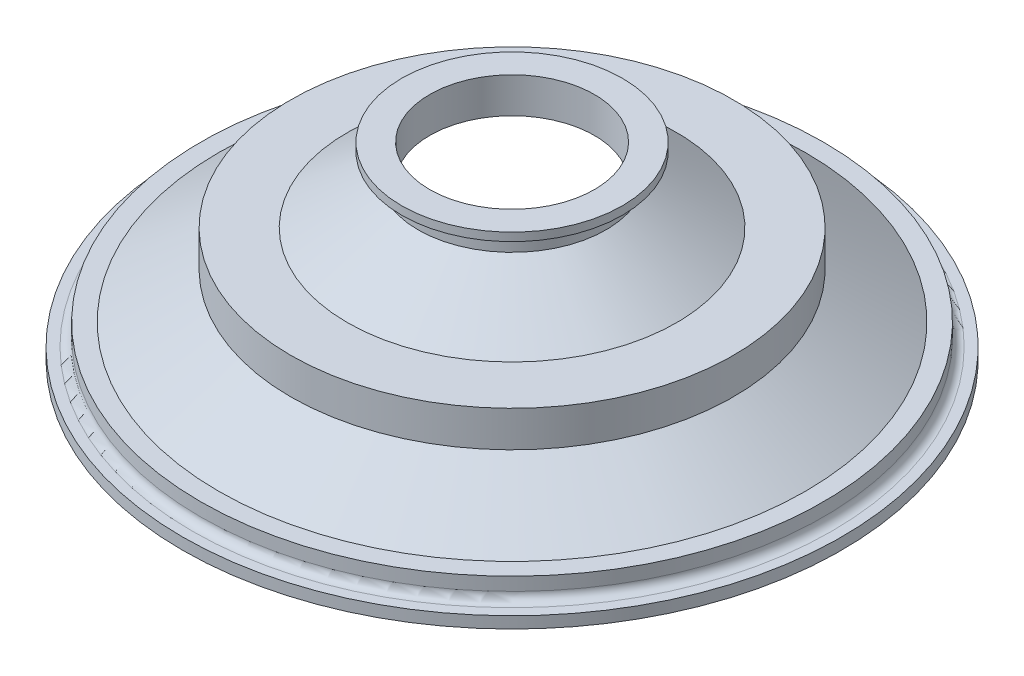
from build123d import *


with BuildPart() as part:
    # Sketch1 → Revolve1 (revolve)
    with BuildSketch(Plane.XY, mode=Mode.PRIVATE) as revolve1_sk:
        with BuildLine():
            Line((88, 6.5), (56.826927003, 26.292427299))
            Line((56.826927003, 26.292427299), (63.663285359, 26.292427299))
            Line((63.663285359, 26.292427299), (63.663285359, 31.292427299))
            Line((63.663285359, 31.292427299), (48.951927003, 31.292427299))
            Line((48.951927003, 31.292427299), (25, 46.5))
            Line((25, 46.5), (25, 57.273651824))
            Line((25, 57.273651824), (33.5, 57.273651824))
            Line((33.5, 57.273651824), (33.5, 54.773651824))
            Line((33.5, 54.773651824), (28.5, 54.773651824))
            Line((28.5, 54.773651824), (28.5, 48.423651824))
            Line((28.5, 48.423651824), (49.969178626, 34.792427299))
            Line((49.969178626, 34.792427299), (67.163285359, 34.792427299))
            Line((67.163285359, 34.792427299), (67.163285359, 23.875534136))
            Line((67.163285359, 23.875534136), (89.017251622, 10))
            Line((89.017251622, 10), (94.5, 10))
            Line((94.5, 10), (94.5, 6))
            ThreePointArc((94.5, 6), (95.232233047, 4.232233047), (97, 3.5))
            Line((97, 3.5), (100, 3.5))
            Line((100, 3.5), (100, 0))
            Line((100, 0), (97, 0))
            ThreePointArc((97, 0), (92.757359313, 1.757359313), (91, 6))
            Line((91, 6), (91, 6.5))
            Line((91, 6.5), (88, 6.5))
        make_face()
    revolve(revolve1_sk.sketch.rotate(Axis((0, 60.137334415, 0), (0, -1, 0)), 90), axis=Axis((0, 60.137334415, 0), (0, -1, 0)))


solid = part.part
